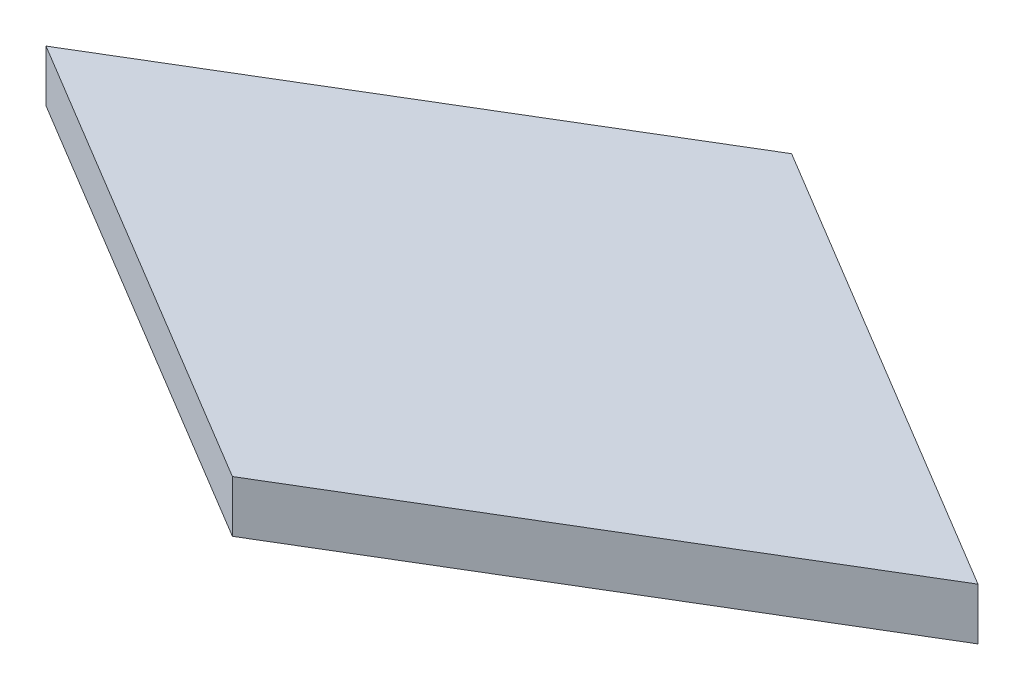
from build123d import *

# Parameters (mm, degrees)
EXTRUDE_1_DEPTH = 5


with BuildPart() as part:
    # 草图1 → 凸台-拉伸1 (new body)
    with BuildSketch(Plane(origin=(0, 0, 0), x_dir=(1, 0, 0), z_dir=(0, 1, 0))):
        Polygon((45, 0), (0, 27), (-45, 0), (0, -27), align=None)
    extrude(amount=EXTRUDE_1_DEPTH)


solid = part.part
